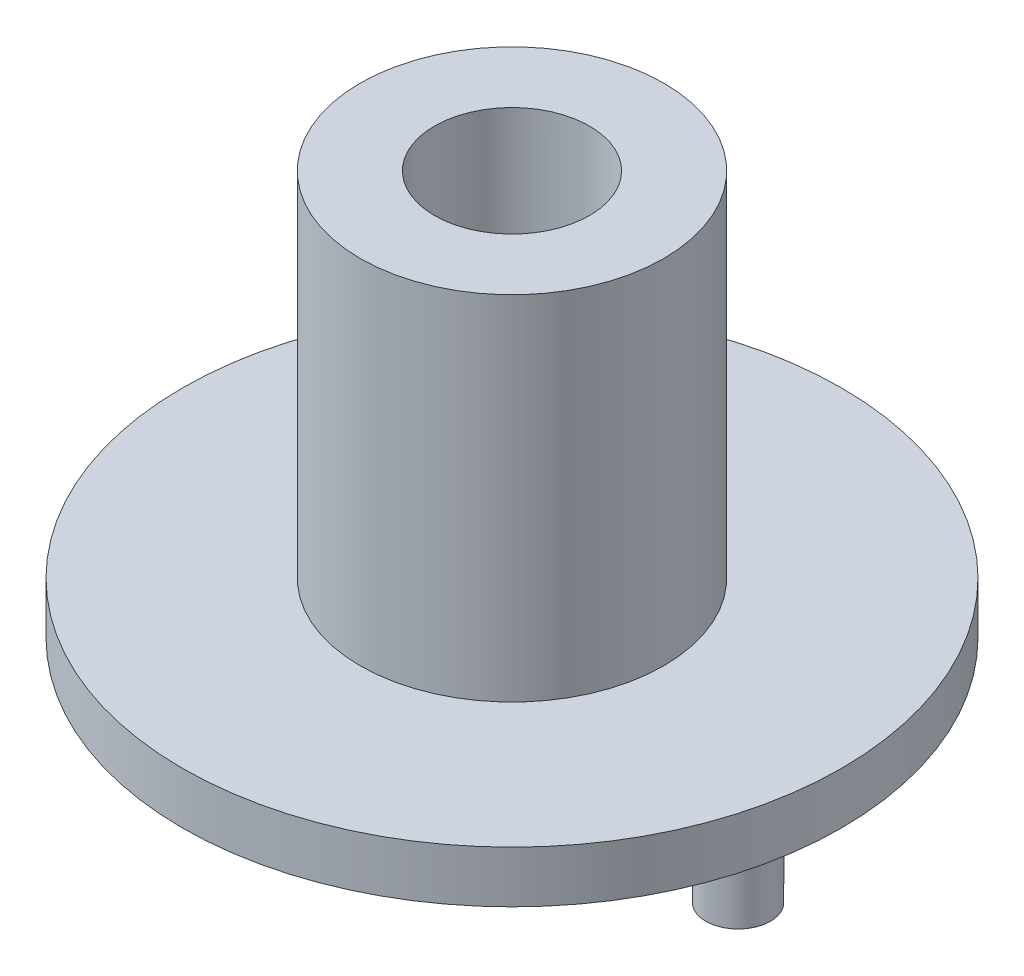
from build123d import *

# Parameters (mm, degrees)
SKETCH_1_R               = 25.5
SKETCH_1_R_2             = 6
EXTRUDE_1_DEPTH          = 4
SKETCH_2_R               = 11.75
SKETCH_2_R_2             = 6
EXTRUDE_2_DEPTH          = 27.3
SKETCH_3_R               = 2.5
EXTRUDE_3_DEPTH          = 9
CUT_EXTRUDE_1_REACH      = 49.751
CUT_EXTRUDE_1_END_RADIUS = 11.75
SKETCH_5_R               = 3


with BuildPart() as part:
    # Эскиз1 → Бобышка-Вытянуть1 (new body)
    with BuildSketch(Plane(origin=(0, 0, 0), x_dir=(1, 0, 0), z_dir=(0, 1, 0))):
        with Locations(Location((0, 0, 0), (0, 0, 270))):
            Circle(SKETCH_1_R)
        with Locations(Location((0, 0, 0), (0, 0, 270))):
            Circle(SKETCH_1_R_2, mode=Mode.SUBTRACT)
    extrude(amount=EXTRUDE_1_DEPTH)

    # Эскиз2 → Бобышка-Вытянуть2 (add)
    with BuildSketch(Plane(origin=(0, 4, 0), x_dir=(1, 0, 0), z_dir=(0, 1, 0))):
        with Locations(Location((0, 0, 0), (0, 0, 270))):
            Circle(SKETCH_2_R)
        with Locations(Location((0, 0, 0), (0, 0, 270))):
            Circle(SKETCH_2_R_2, mode=Mode.SUBTRACT)
    extrude(amount=EXTRUDE_2_DEPTH)

    # Эскиз3 → Бобышка-Вытянуть3 (add)
    with BuildSketch(Plane.XZ):
        with Locations(Location((-17.5, 0, 0), (0, 0, 90))):
            Circle(SKETCH_3_R)
        with Locations(Location((17.5, 0, 0), (0, 0, 90))):
            Circle(SKETCH_3_R)
    extrude(amount=EXTRUDE_3_DEPTH)

    # Вырез-Вытянуть1: up to this cylinder (the profile starts inside it)
    cut_extrude_1_end = Plane(origin=(0, 21.3, 0), z_dir=(0, -1, 0)) * Cylinder(CUT_EXTRUDE_1_END_RADIUS, 124.002, mode=Mode.PRIVATE)
    # Эскиз5 → Вырез-Вытянуть1 (cut, up to the surface)
    with BuildSketch(Plane.XY, mode=Mode.PRIVATE) as cut_extrude_1_sk1:
        with Locations((0, 21.3)):
            Circle(SKETCH_5_R)
    cut_extrude_1_tool1 = extrude(cut_extrude_1_sk1.sketch, amount=-CUT_EXTRUDE_1_REACH, mode=Mode.PRIVATE) & cut_extrude_1_end
    add(cut_extrude_1_tool1.solids().sort_by_distance((0, 21.3, 0))[0], mode=Mode.SUBTRACT)


solid = part.part
